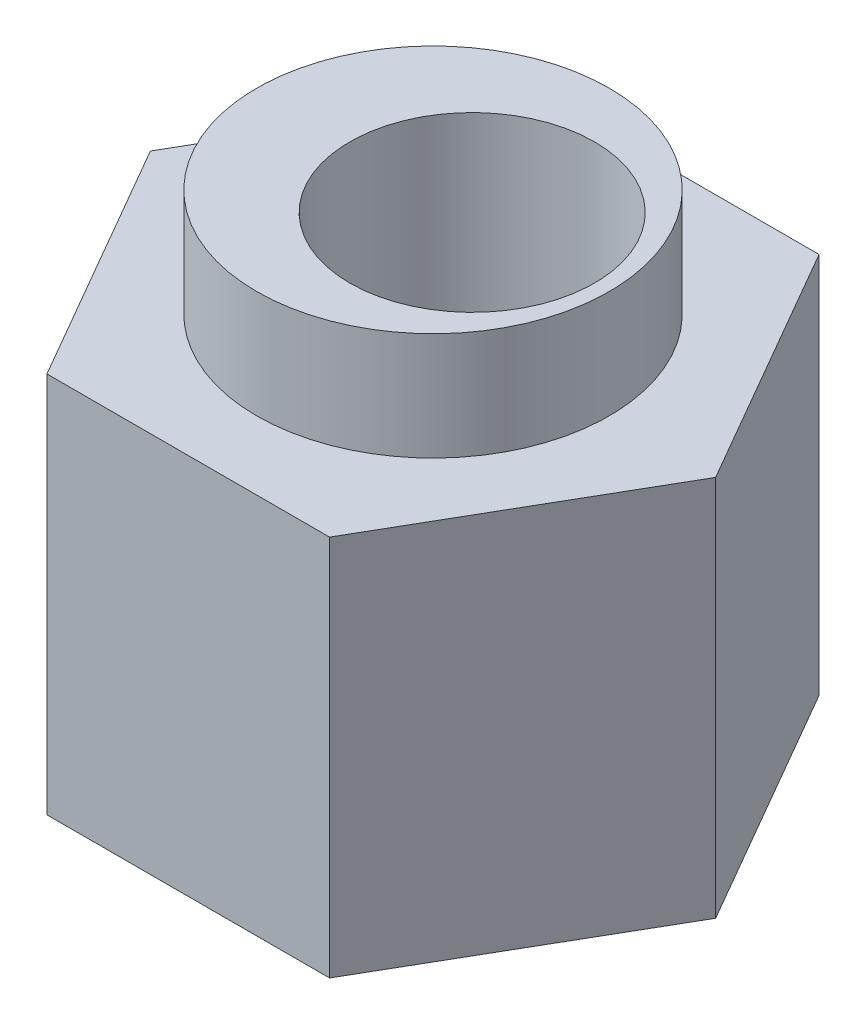
from build123d import *

# Parameters (mm, degrees)
BOSS_EXTRUDE1_DEPTH     = 7.8
SKETCH2_R               = 3.6
BOSS_EXTRUDE2_DEPTH     = 2.2
BOSS_EXTRUDE3_START     = 0.4
SKETCH3_R               = 3.6
BOSS_EXTRUDE3_DEPTH     = 0.4
CUT_EXTRUDE1_DEPTH      = 13.583057392
CUT_EXTRUDE1_DEPTH_BACK = 13.583057392
SKETCH4_R               = 2.5


with BuildPart() as part:
    # Sketch1 → Boss-Extrude1 (new body)
    with BuildSketch(Plane(origin=(0, 0, 0), x_dir=(1, 0, 0), z_dir=(0, 1, 0))):
        Polygon((5.773502692, 0), (2.886751346, 5), (-2.886751346, 5), (-5.773502692, 0), (-2.886751346, -5), (2.886751346, -5), align=None)
    extrude(amount=BOSS_EXTRUDE1_DEPTH)

    # Sketch2 → Boss-Extrude2 (add)
    with BuildSketch(Plane(origin=(0, 7.8, 0), x_dir=(1, 0, 0), z_dir=(0, 1, 0))):
        with Locations(Location((0, 0, 0), (0, 0, 270))):
            Circle(SKETCH2_R)
    extrude(amount=BOSS_EXTRUDE2_DEPTH)

    # Sketch3 → Boss-Extrude3 (add)
    with BuildSketch(Plane.XZ.offset(BOSS_EXTRUDE3_START)):
        with Locations(Location((0, 0, 0), (0, 0, 90))):
            Circle(SKETCH3_R)
    extrude(amount=-BOSS_EXTRUDE3_DEPTH)

    # Sketch4 → Cut-Extrude1 (cut, two sides: drawn at the far end of the back side and taken through both)
    with BuildSketch(Plane(origin=(0, 0, 0), x_dir=(1, 0, 0), z_dir=(0, 1, 0)).offset(-CUT_EXTRUDE1_DEPTH_BACK)):
        with Locations(Location((0.8, 0, 0), (0, 0, 270))):
            Circle(SKETCH4_R)
    extrude(amount=CUT_EXTRUDE1_DEPTH + CUT_EXTRUDE1_DEPTH_BACK, mode=Mode.SUBTRACT)


solid = part.part
